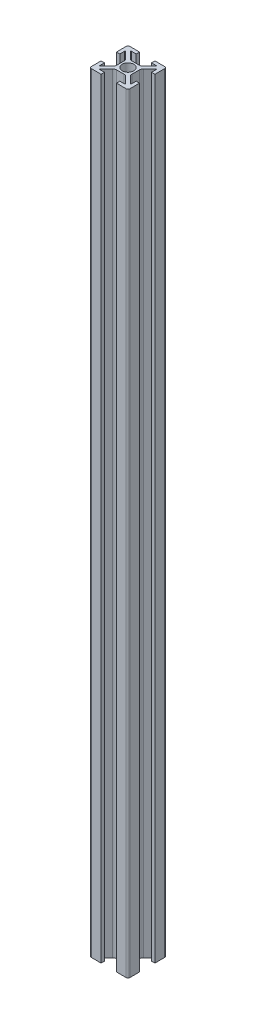
from build123d import *

# Parameters (mm, degrees)
ESBO_O1_W                = 20
ESBO_O1_H                = 20
ESBO_O1_R                = 3
RESSALTO_EXTRUS_O1_DEPTH = 200
ESBO_O2_W                = 8
ESBO_O2_H                = 1.75
CORTE_EXTRUS_O1_DEPTH    = 401.249921924
PADR_OCIRCULAR2_COUNT    = 4
FILETE2_R                = 1
FILETE3_R                = 2
FILETE4_R                = 0.25


with BuildPart() as part:
    # Esboço1 → Ressalto-extrusão1 (new, symmetric)
    with BuildSketch(Plane(origin=(0, 0, 0), x_dir=(1, 0, 0), z_dir=(0, 1, 0))):
        Rectangle(ESBO_O1_W, ESBO_O1_H)
        with Locations(Location((0, 0, 0), (0, 0, 270))):
            Circle(ESBO_O1_R, mode=Mode.SUBTRACT)
    extrude(amount=RESSALTO_EXTRUS_O1_DEPTH, both=True)

    # Esboço2 → Corte-extrusão1 (cut, through all)
    with BuildSketch(Plane(origin=(0, 200, 0), x_dir=(1, 0, 0), z_dir=(0, 1, 0))):
        Polygon((-7.05, 8.25), (-2.8, 4), (2.8, 4), (7.05, 8.25), (4, 8.25), (-4, 8.25), align=None)
        with Locations((0, 9.125)):
            Rectangle(ESBO_O2_W, ESBO_O2_H)
    corte_extrus_o1 = extrude(amount=-CORTE_EXTRUS_O1_DEPTH, mode=Mode.SUBTRACT)

    # PadrãoCircular2: Corte-extrusão1 ×4 about axis
    padr_ocircular2_axis = Axis((0, 0, 0), (0, 1, 0))
    for i in range(1, PADR_OCIRCULAR2_COUNT):
        add(corte_extrus_o1.rotate(padr_ocircular2_axis, i * 360 / PADR_OCIRCULAR2_COUNT), mode=Mode.SUBTRACT)

    # Filete2
    filete2_edges = [part.edges().sort_by_distance(p)[0] for p in [
        (10, 0, 10),
        (-10, 0, 10),
        (-10, 0, -10),
        (10, 0, -10),
    ]]
    fillet(filete2_edges, radius=FILETE2_R)

    # Filete3
    filete3_edges = [part.edges().sort_by_distance(p)[0] for p in [
        (-4, 0, -2.8),
        (-4, 0, 2.8),
        (2.8, 0, -4),
        (-2.8, 0, -4),
        (4, 0, 2.8),
        (4, 0, -2.8),
        (-2.8, 0, 4),
        (2.8, 0, 4),
    ]]
    fillet(filete3_edges, radius=FILETE3_R)

    # Filete4
    filete4_edges = [part.edges().sort_by_distance(p)[0] for p in [
        (-8.25, 0, -7.05),
        (-8.25, 0, 7.05),
        (7.05, 0, -8.25),
        (-7.05, 0, -8.25),
        (8.25, 0, 7.05),
        (8.25, 0, -7.05),
        (-7.05, 0, 8.25),
        (7.05, 0, 8.25),
    ]]
    fillet(filete4_edges, radius=FILETE4_R)


solid = part.part
